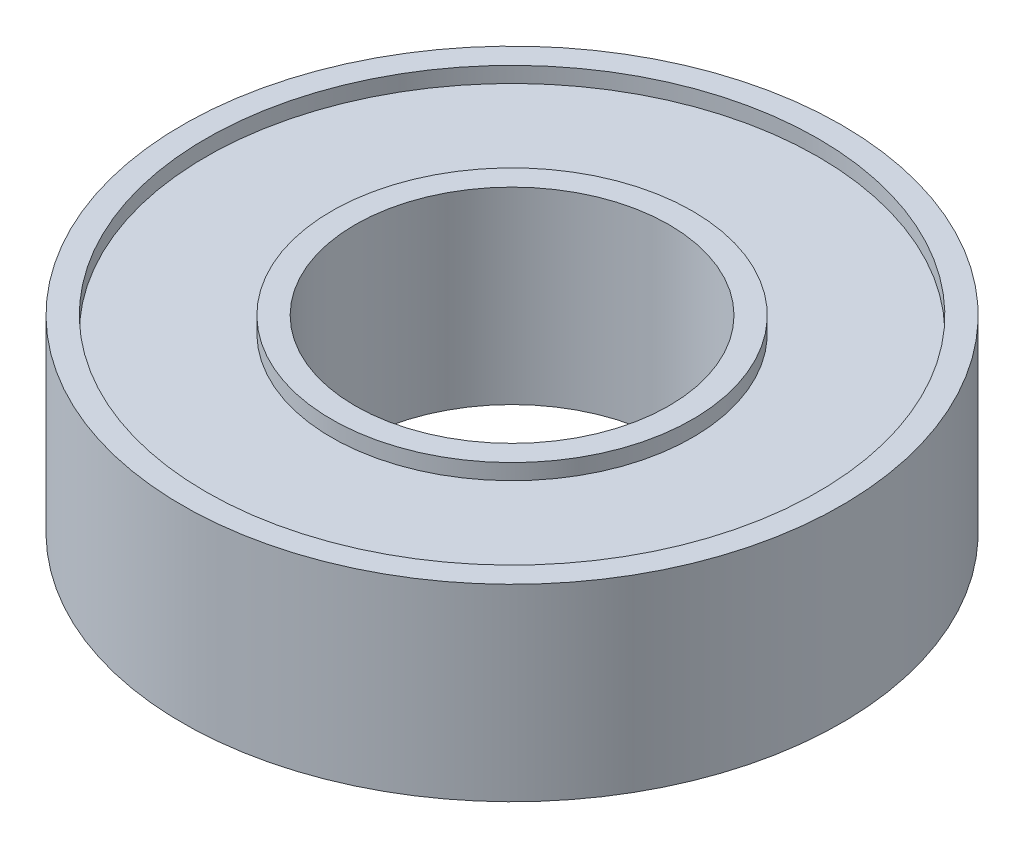
from build123d import *


with BuildPart() as part:
    # Croquis1 → Revolución1 (revolve)
    with BuildSketch(Plane.XY, mode=Mode.PRIVATE) as revoluci_n1_sk:
        Polygon((-10, 6.856705357), (-10, 18.856705357), (-11.5, 18.856705357), (-11.5, 17.856705357), (-19.5, 17.856705357), (-19.5, 18.856705357), (-21, 18.856705357), (-21, 6.856705357), (-19.5, 6.856705357), (-19.5, 7.856705357), (-11.5, 7.856705357), (-11.5, 6.856705357), align=None)
    revolve(revoluci_n1_sk.sketch.rotate(Axis((0, 0, 0), (0, 1, 0)), 270), axis=Axis((0, 0, 0), (0, 1, 0)))


solid = part.part
